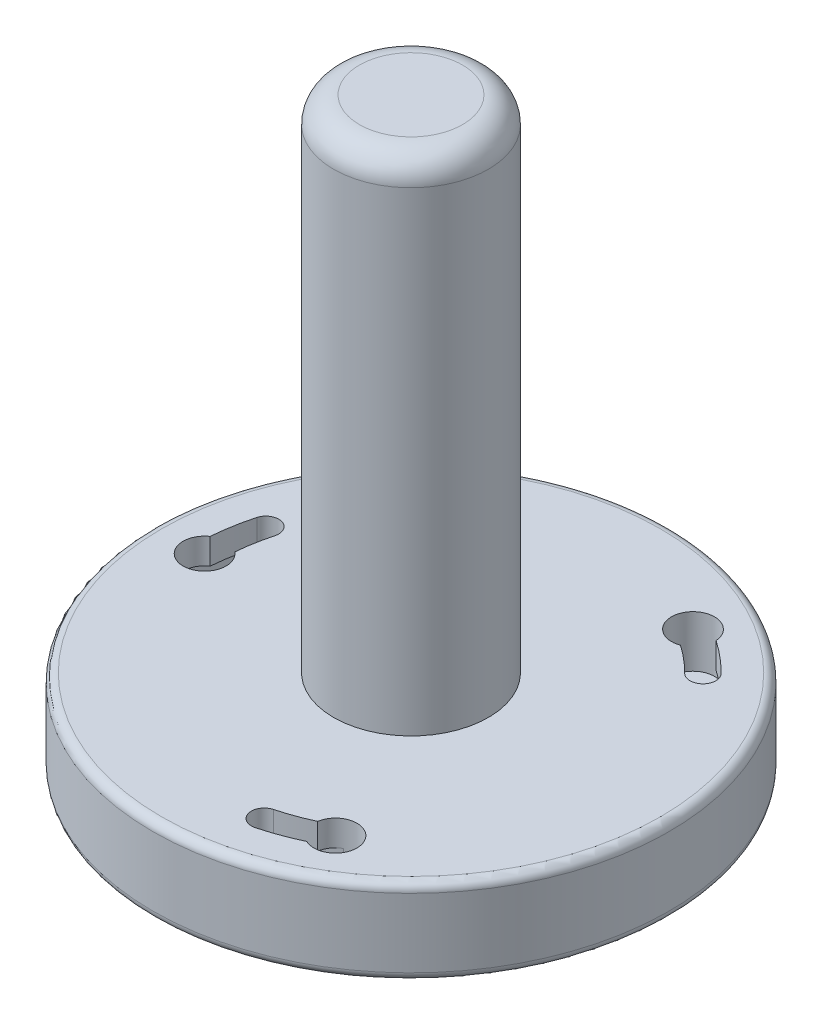
from build123d import *
from build123d.topology import SkipClean

# Parameters (mm, degrees)
SKETCH1_R           = 38.1
BOSS_EXTRUDE1_DEPTH = 12.7
SKETCH2_R           = 11.43
BOSS_EXTRUDE2_DEPTH = 73.914
FILLET1_R           = 1.27
FILLET2_R           = 1.27
FILLET3_R           = 3.81
CUT_EXTRUDE2_DEPTH  = 3.81
CUT_EXTRUDE3_DEPTH  = 3.81


with BuildPart() as part:
    # Sketch1 → Boss-Extrude1 (new body)
    with BuildSketch(Plane(origin=(0, 0, 0), x_dir=(1, 0, 0), z_dir=(0, 1, 0))):
        with Locations(Location((0, 0, 0), (0, 0, 270))):
            Circle(SKETCH1_R)
    extrude(amount=BOSS_EXTRUDE1_DEPTH)

    # Sketch2 → Boss-Extrude2 (add)
    with BuildSketch(Plane(origin=(0, 12.7, 0), x_dir=(1, 0, 0), z_dir=(0, 1, 0))):
        with Locations(Location((0, 0, 0), (0, 0, 270))):
            Circle(SKETCH2_R)
    extrude(amount=BOSS_EXTRUDE2_DEPTH)

    # Fillet1
    fillet1_edges = [part.edges().sort_by_distance(p)[0] for p in [
        (0, 12.7, -38.1),
    ]]
    fillet(fillet1_edges, radius=FILLET1_R)

    # Fillet2
    fillet2_edges = [part.edges().sort_by_distance(p)[0] for p in [
        (0, 0, -38.1),
    ]]
    fillet(fillet2_edges, radius=FILLET2_R)

    # Fillet3
    fillet3_edges = [part.edges().sort_by_distance(p)[0] for p in [
        (0, 86.614, -11.43),
    ]]
    fillet(fillet3_edges, radius=FILLET3_R)

    # Sketch4 → Cut-Extrude2 (cut)
    with BuildSketch(Plane(origin=(0, 12.7, 0), x_dir=(-1, 0, 0), z_dir=(0, -1, 0))):
        with BuildLine():
            ThreePointArc((-12.106701586, -25.883554657), (-18.053418689, -24.924958375), (-13.874033018, -29.26259443))
            ThreePointArc((-13.874033018, -29.26259443), (-11.127331545, -30.41333125), (-8.286537239, -31.306892621))
            ThreePointArc((-8.286537239, -31.306892621), (-5.957511953, -29.952754069), (-7.311650505, -27.623728783))
            ThreePointArc((-7.311650505, -27.623728783), (-9.748084477, -26.860853933), (-12.106701586, -25.883554657))
        make_face()
        with BuildLine():
            ThreePointArc((28.469166667, 2.457066199), (30.612356486, -3.172240023), (32.279166667, 2.616032168))
            ThreePointArc((32.279166667, 2.616032168), (31.902383248, 5.570113831), (31.255832943, 8.477094553))
            ThreePointArc((31.255832943, 8.477094553), (28.918601914, 9.81702034), (27.578676126, 7.479789311))
            ThreePointArc((27.578676126, 7.479789311), (28.136224112, 4.988338171), (28.469166667, 2.457066199))
        make_face()
        with BuildLine():
            ThreePointArc((-16.36246508, 23.426488458), (-12.558937796, 28.097198398), (-18.405133648, 26.646562262))
            ThreePointArc((-18.405133648, 26.646562262), (-20.775051704, 24.843217419), (-22.969295704, 22.829798069))
            ThreePointArc((-22.969295704, 22.829798069), (-22.961089961, 20.135733729), (-20.267025621, 20.143939472))
            ThreePointArc((-20.267025621, 20.143939472), (-18.388139635, 21.872515762), (-16.36246508, 23.426488458))
        make_face()
    extrude(amount=CUT_EXTRUDE2_DEPTH, mode=Mode.SUBTRACT)

    # Sketch5 → Cut-Extrude3 (cut)
    with SkipClean():  # the faces are left unmerged after this step: merging them gives an invalid solid
        with BuildSketch(Plane(origin=(0, 8.89, 0), x_dir=(1, 0, 0), z_dir=(0, 1, 0))):
            with BuildLine():
                ThreePointArc((16.8275, -29.146084964), (17.989630657, -24.808954307), (13.6525, -23.64682365))
                ThreePointArc((13.6525, -23.64682365), (10.410740895, -25.242414683), (6.98668826, -26.396007504))
                ThreePointArc((6.98668826, -26.396007504), (4.729790674, -30.277716314), (8.611499483, -32.5346139))
                ThreePointArc((8.611499483, -32.5346139), (12.831843428, -31.112743679), (16.8275, -29.146084964))
            make_face()
            with BuildLine():
                ThreePointArc((-32.481551882, 8.809529633), (-33.360348122, 4.443669453), (-33.655, 0))
                ThreePointArc((-33.655, 0), (-30.48, -3.175), (-27.305, 0))
                ThreePointArc((-27.305, 0), (-27.065942816, 3.605241255), (-26.352957187, 7.147354231))
                ThreePointArc((-26.352957187, 7.147354231), (-28.586166833, 11.042739279), (-32.481551882, 8.809529633))
            make_face()
            with BuildLine():
                ThreePointArc((23.870052398, 23.725084267), (20.528504693, 26.669074226), (16.8275, 29.146084964))
                ThreePointArc((16.8275, 29.146084964), (12.490369343, 27.983954307), (13.6525, 23.64682365))
                ThreePointArc((13.6525, 23.64682365), (16.655201921, 21.637173428), (19.366268927, 19.248653274))
                ThreePointArc((19.366268927, 19.248653274), (23.85637616, 19.234977035), (23.870052398, 23.725084267))
            make_face()
        extrude(amount=-CUT_EXTRUDE3_DEPTH, mode=Mode.SUBTRACT)


solid = part.part
